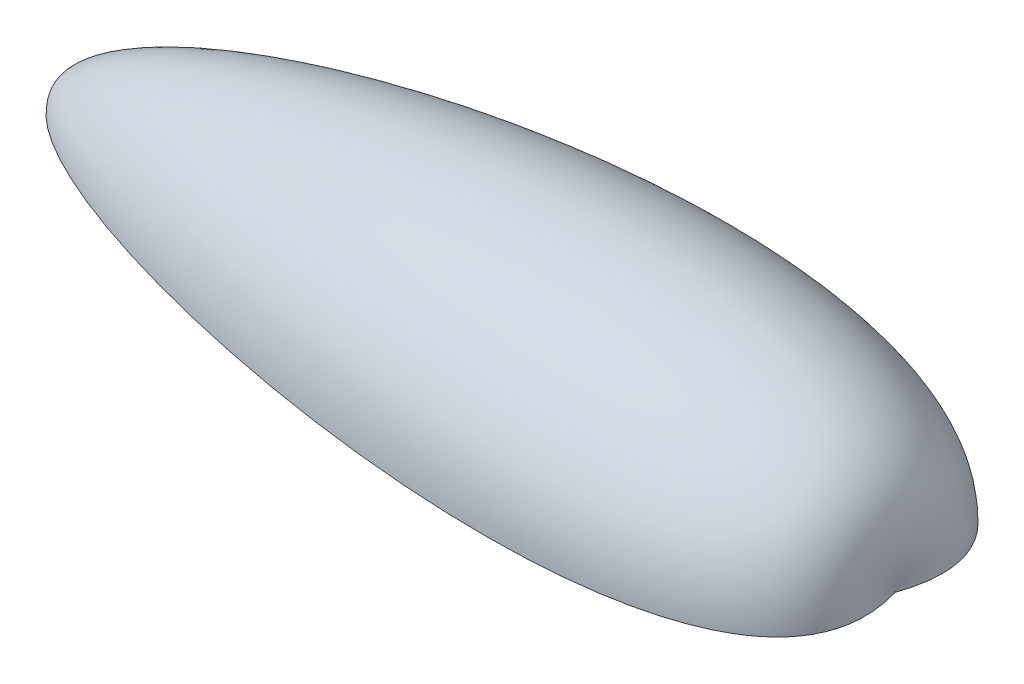
from build123d import *

# Parameters (mm, degrees)
REVOLVE1_ANGLE = 180


with BuildPart() as part:
    # Sketch2 → Revolve1 (revolve)
    with BuildSketch(Plane(origin=(0, 0, 0), x_dir=(1, 0, 0), z_dir=(0, 1, 0))):
        with BuildLine():
            Line((-62.077528171, -3.456708638), (39.522471829, -5.753517148))
            add(Edge.make_bspline(
                [(-62.077528171, -3.456708638), (-61.594882202, 11.674946461), (51.368692541, 28.505895448), (39.522471829, -5.753517148)],
                knots=[0, 0, 0, 0, 1, 1, 1, 1], degree=3))
        make_face()
    revolve(axis=Axis((-62.077528171, 0, 3.456708638), (0.9997445736216019, 0, 0.022600608712190415)), revolution_arc=REVOLVE1_ANGLE)


solid = part.part
